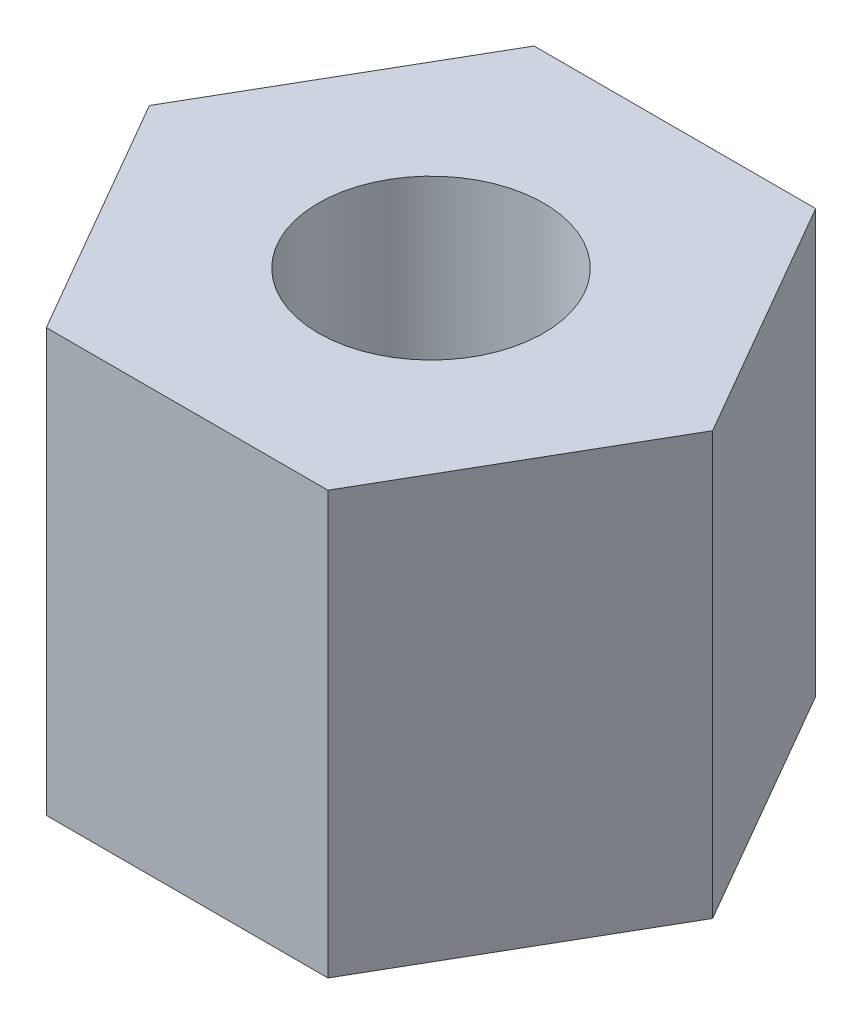
from build123d import *

# Parameters (mm, degrees)
SKETCH1_R           = 4
BOSS_EXTRUDE1_DEPTH = 15


with BuildPart() as part:
    # Sketch1 → Boss-Extrude1 (new body)
    with BuildSketch(Plane(origin=(0, 0, 0), x_dir=(1, 0, 0), z_dir=(0, 1, 0))):
        Polygon((10, 0), (5, 8.660254038), (-5, 8.660254038), (-10, 0), (-5, -8.660254038), (5, -8.660254038), align=None)
        with Locations(Location((0, 0, 0), (0, 0, 270))):
            Circle(SKETCH1_R, mode=Mode.SUBTRACT)
    extrude(amount=BOSS_EXTRUDE1_DEPTH)


solid = part.part
